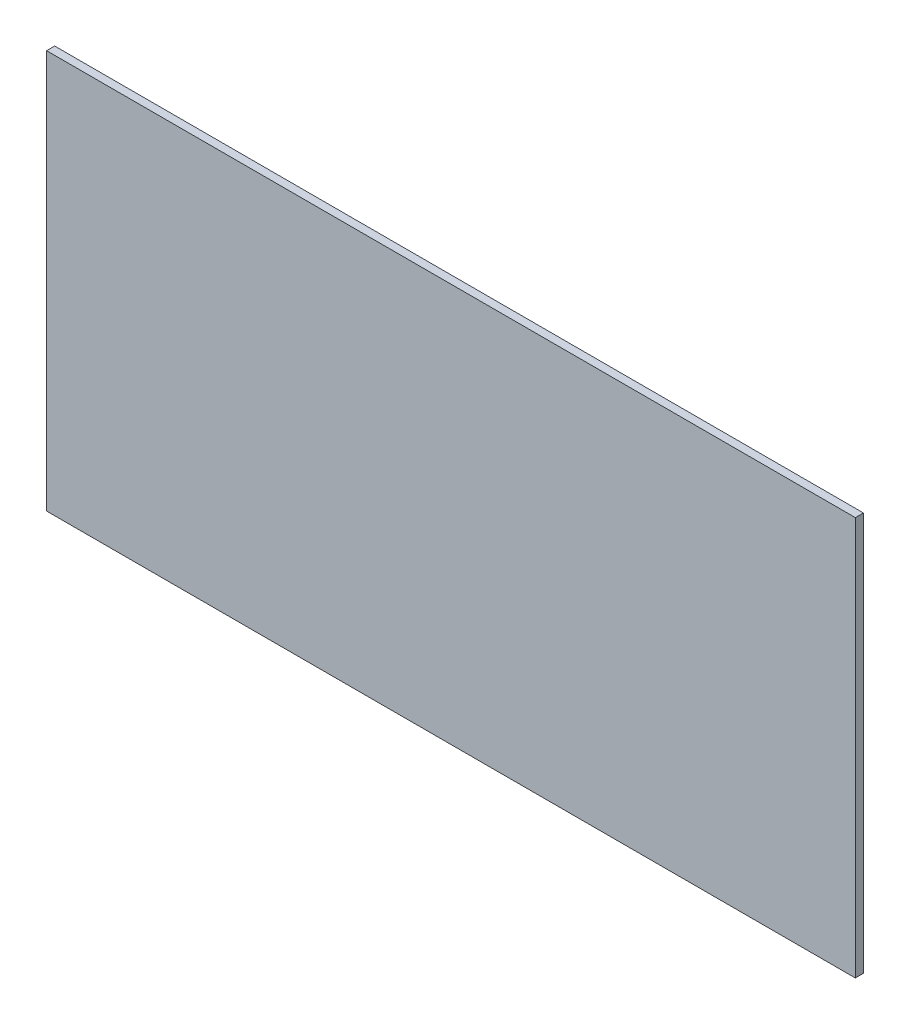
from build123d import *

# Parameters (mm, degrees)
SKETCH1_W           = 317.55
SKETCH1_H           = 156.55
BOSS_EXTRUDE1_DEPTH = 3.175


with BuildPart() as part:
    # Sketch1 → Boss-Extrude1 (new body)
    with BuildSketch(Plane.XY):
        Rectangle(SKETCH1_W, SKETCH1_H)
    extrude(amount=BOSS_EXTRUDE1_DEPTH)


solid = part.part
